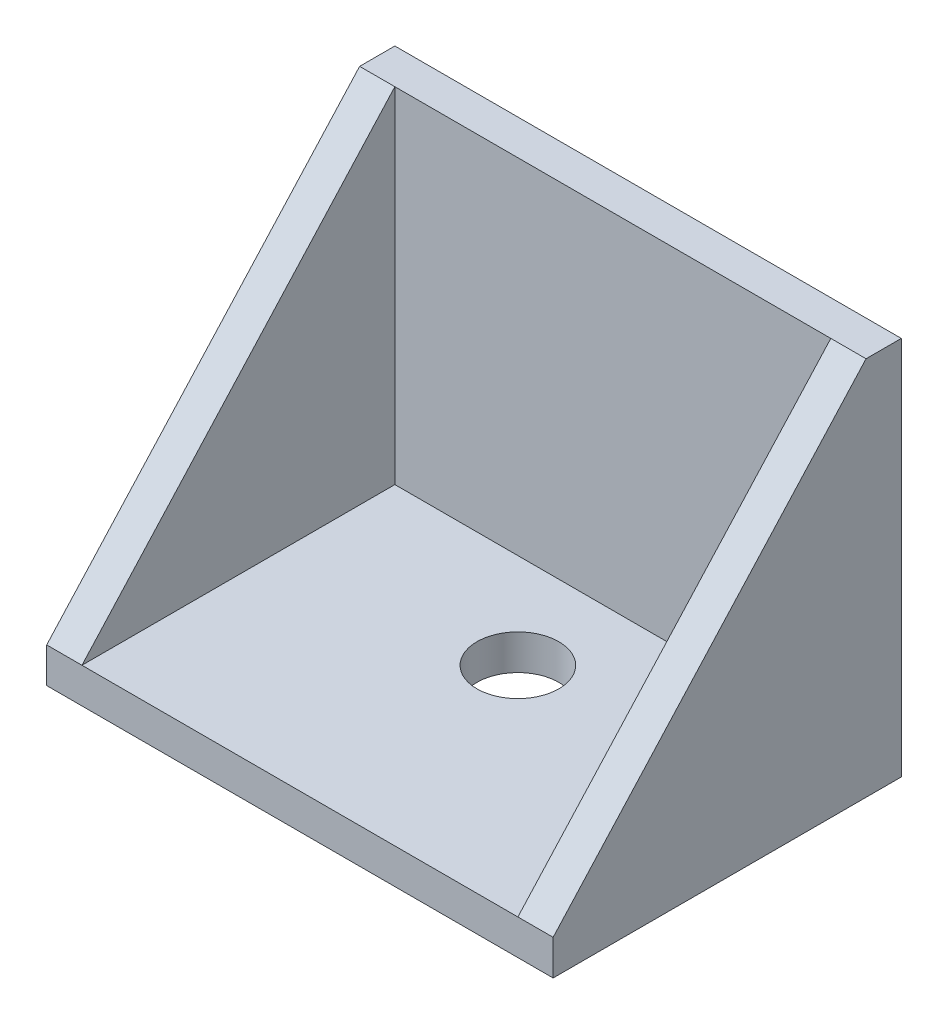
from build123d import *

# Parameters (mm, degrees)
SKETCH1_W                = 50.8
SKETCH1_H                = 34.925
BOSS_EXTRUDE1_DEPTH      = 3.53568
BOSS_EXTRUDE2_START      = -3.53568
BOSS_EXTRUDE2_DEPTH      = 38.1
CUT_EXTRUDE1_DEPTH       = 66.857337528
F_5_16_CLEARANCE_HOLE1_D = 8.2042


with BuildPart() as part:
    # Sketch1 → Boss-Extrude1 (new body)
    with BuildSketch(Plane(origin=(0, 0, 0), x_dir=(1, 0, 0), z_dir=(0, 1, 0))):
        Rectangle(SKETCH1_W, SKETCH1_H)
    extrude(amount=BOSS_EXTRUDE1_DEPTH)

    # Sketch2 → Boss-Extrude2 (add)
    with BuildSketch(Plane(origin=(0, 3.53568, 0), x_dir=(1, 0, 0), z_dir=(0, 1, 0)).offset(BOSS_EXTRUDE2_START)):
        Polygon((21.86432, -17.4625), (25.4, -17.4625), (25.4, 17.4625), (-25.4, 17.4625), (-25.4, -17.4625), (-21.86432, -17.4625), (-21.86432, 13.92682), (21.86432, 13.92682), align=None)
    extrude(amount=BOSS_EXTRUDE2_DEPTH)

    # Sketch3 → Cut-Extrude1 (cut, through all)
    with BuildSketch(Plane(origin=(25.4, 0, 0), x_dir=(0, 0, -1), z_dir=(1, 0, 0))):
        Polygon((-17.4625, 3.53568), (13.92682, 38.1), (-17.4625, 38.1), align=None)
    extrude(amount=-CUT_EXTRUDE1_DEPTH, mode=Mode.SUBTRACT)

    # 5/16 Clearance Hole1 (through all)
    with Locations(Plane(origin=(0, 3.53568, 0), x_dir=(1, 0, 0), z_dir=(0, 1, 0))):
        with Locations((0, 4.40182)):
            Hole(F_5_16_CLEARANCE_HOLE1_D / 2)


solid = part.part
